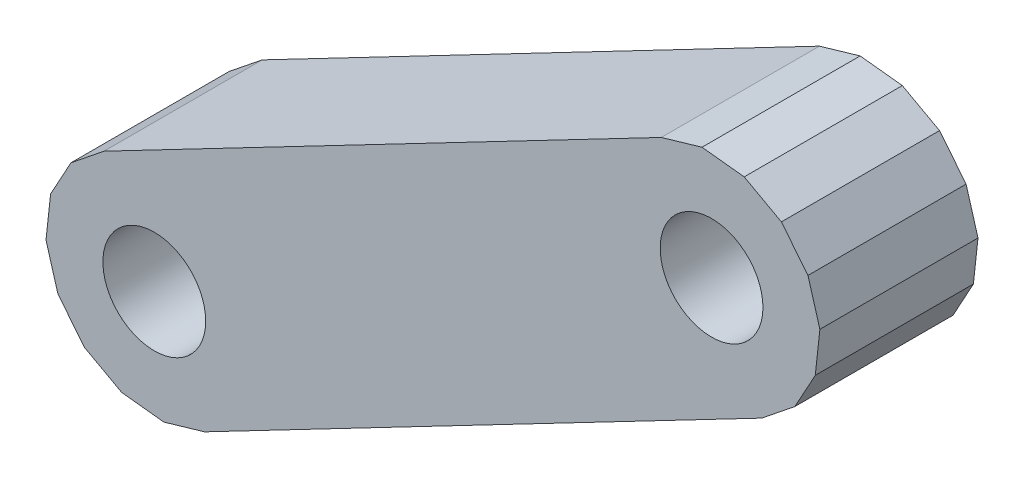
from build123d import *

# Parameters (mm, degrees)
HIGH_SLIDER_LINK_DEPTH = 8
SKETCH_2_R             = 2.6
PIN_BORE_DEPTH         = 67.137967524
SKETCH_3_R             = 2.6
CUT_EXTRUDE_2_DEPTH    = 67.137967524


with BuildPart() as part:
    # 草图1 → High_slider_link (new body)
    with BuildSketch(Plane.XY):
        Polygon((43.733202086, 35.819954019), (45.406009546, 37.164202316), (46.437060568, 39.046281505), (46.66938698, 41.17966209), (46.067619192, 43.239556216), (44.723370895, 44.912363676), (42.841291706, 45.943414698), (40.707911121, 46.17574111), (38.648016994, 45.573973323), (10.457407454, 30.877009652), (8.784599994, 29.532761355), (7.753548972, 27.650682166), (7.52122256, 25.517301581), (8.122990348, 23.457407454), (9.467238645, 21.784599994), (11.349317834, 20.753548972), (13.482698419, 20.52122256), (15.542592546, 21.122990348), align=None)
    extrude(amount=HIGH_SLIDER_LINK_DEPTH)

    # 草图2 → Pin_bore (cut, through all)
    with BuildSketch(Plane.XY.offset(8)):
        with Locations((41.19060954, 40.696963671)):
            Circle(SKETCH_2_R)
    extrude(amount=-PIN_BORE_DEPTH, mode=Mode.SUBTRACT)

    # 草图3 → 切除-拉伸2 (cut, through all)
    with BuildSketch(Plane.XY.offset(8)):
        with Locations((13, 26)):
            Circle(SKETCH_3_R)
    extrude(amount=-CUT_EXTRUDE_2_DEPTH, mode=Mode.SUBTRACT)


solid = part.part
